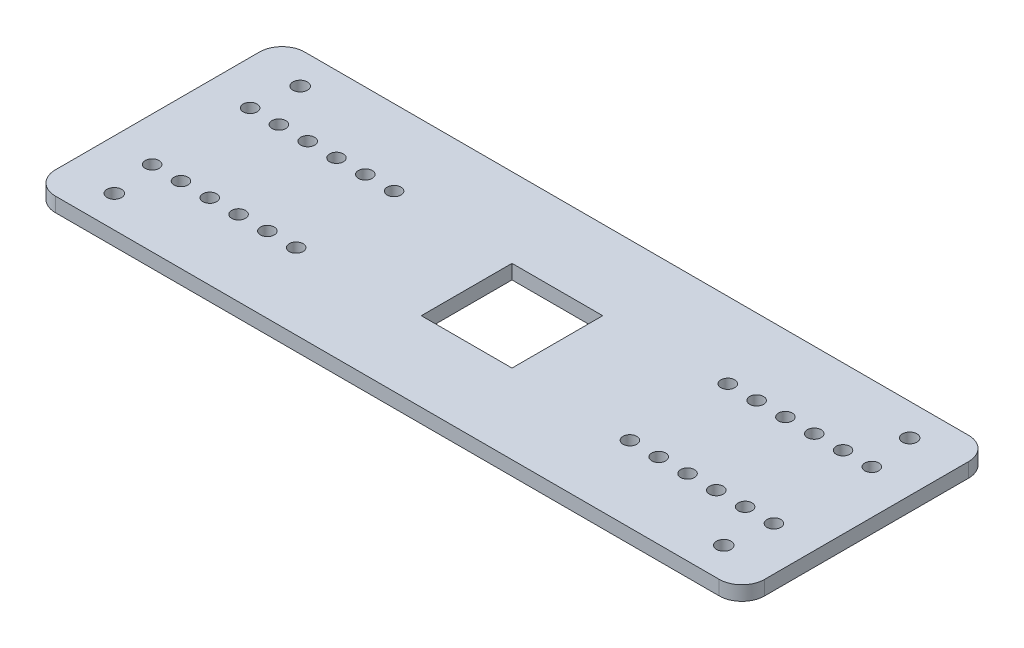
from build123d import *

# Parameters (mm, degrees)
SKETCH1_W           = 156.4
SKETCH1_H           = 55
BOSS_EXTRUDE1_DEPTH = 3.175
SKETCH2_R           = 1.524
CUT_EXTRUDE1_DEPTH  = 83.955232656
SKETCH4_R           = 1.6
CUT_EXTRUDE2_DEPTH  = 83.955232656
SKETCH5_W           = 20
SKETCH5_H           = 20
CUT_EXTRUDE3_DEPTH  = 83.955232656
FILLET1_R           = 5


with BuildPart() as part:
    # Sketch1 → Boss-Extrude1 (new body)
    with BuildSketch(Plane(origin=(0, 0, 0), x_dir=(1, 0, 0), z_dir=(0, 1, 0))):
        Rectangle(SKETCH1_W, SKETCH1_H)
    extrude(amount=BOSS_EXTRUDE1_DEPTH)

    # Sketch2 → Cut-Extrude1 (cut, through all)
    with BuildSketch(Plane(origin=(0, 3.175, 0), x_dir=(1, 0, 0), z_dir=(0, 1, 0))):
        with Locations(Location((-68.547999997, -10.795000003, 0), (0, 0, 270))):
            Circle(SKETCH2_R)
        with Locations(Location((-62.197999997, -10.795000003, 0), (0, 0, 270))):
            Circle(SKETCH2_R)
        with Locations(Location((-55.847999997, -10.795000003, 0), (0, 0, 270))):
            Circle(SKETCH2_R)
        with Locations(Location((-49.497999997, -10.795000003, 0), (0, 0, 270))):
            Circle(SKETCH2_R)
        with Locations(Location((-43.147999997, -10.795000003, 0), (0, 0, 270))):
            Circle(SKETCH2_R)
        with Locations(Location((-36.797999997, -10.795000003, 0), (0, 0, 270))):
            Circle(SKETCH2_R)
        with Locations(Location((-68.547999997, 10.795000003, 0), (0, 0, 90))):
            Circle(SKETCH2_R)
        with Locations(Location((-62.197999997, 10.795000003, 0), (0, 0, 90))):
            Circle(SKETCH2_R)
        with Locations(Location((-55.847999997, 10.795000003, 0), (0, 0, 90))):
            Circle(SKETCH2_R)
        with Locations(Location((-49.497999997, 10.795000003, 0), (0, 0, 90))):
            Circle(SKETCH2_R)
        with Locations(Location((-43.147999997, 10.795000003, 0), (0, 0, 90))):
            Circle(SKETCH2_R)
        with Locations(Location((-36.797999997, 10.795000003, 0), (0, 0, 90))):
            Circle(SKETCH2_R)
        with Locations(Location((36.797999997, 10.795000003, 0), (0, 0, 270))):
            Circle(SKETCH2_R)
        with Locations(Location((43.147999997, 10.795000003, 0), (0, 0, 270))):
            Circle(SKETCH2_R)
        with Locations(Location((49.497999997, 10.795000003, 0), (0, 0, 270))):
            Circle(SKETCH2_R)
        with Locations(Location((55.847999997, 10.795000003, 0), (0, 0, 270))):
            Circle(SKETCH2_R)
        with Locations(Location((62.197999997, 10.795000003, 0), (0, 0, 270))):
            Circle(SKETCH2_R)
        with Locations(Location((68.547999997, 10.795000003, 0), (0, 0, 270))):
            Circle(SKETCH2_R)
        with Locations(Location((68.547999997, -10.795000003, 0), (0, 0, 90))):
            Circle(SKETCH2_R)
        with Locations(Location((62.197999997, -10.795000003, 0), (0, 0, 90))):
            Circle(SKETCH2_R)
        with Locations(Location((55.847999997, -10.795000003, 0), (0, 0, 90))):
            Circle(SKETCH2_R)
        with Locations(Location((49.497999997, -10.795000003, 0), (0, 0, 90))):
            Circle(SKETCH2_R)
        with Locations(Location((43.147999997, -10.795000003, 0), (0, 0, 90))):
            Circle(SKETCH2_R)
        with Locations(Location((36.797999997, -10.795000003, 0), (0, 0, 90))):
            Circle(SKETCH2_R)
    extrude(amount=-CUT_EXTRUDE1_DEPTH, mode=Mode.SUBTRACT)

    # Sketch4 → Cut-Extrude2 (cut, through all)
    with BuildSketch(Plane(origin=(0, 3.175, 0), x_dir=(1, 0, 0), z_dir=(0, 1, 0))):
        with Locations(Location((-67.2, -20.5, 0), (0, 0, 270))):
            Circle(SKETCH4_R)
        with Locations(Location((-67.2, 20.5, 0), (0, 0, 90))):
            Circle(SKETCH4_R)
        with Locations(Location((67.2, 20.5, 0), (0, 0, 270))):
            Circle(SKETCH4_R)
        with Locations(Location((67.2, -20.5, 0), (0, 0, 90))):
            Circle(SKETCH4_R)
    extrude(amount=-CUT_EXTRUDE2_DEPTH, mode=Mode.SUBTRACT)

    # Sketch5 → Cut-Extrude3 (cut, through all)
    with BuildSketch(Plane(origin=(0, 3.175, 0), x_dir=(1, 0, 0), z_dir=(0, 1, 0))):
        Rectangle(SKETCH5_W, SKETCH5_H)
    extrude(amount=-CUT_EXTRUDE3_DEPTH, mode=Mode.SUBTRACT)

    # Fillet1
    fillet1_edges = [part.edges().sort_by_distance(p)[0] for p in [
        (78.2, 1.5875, 27.5),
        (-78.2, 1.5875, 27.5),
        (-78.2, 1.5875, -27.5),
        (78.2, 1.5875, -27.5),
    ]]
    fillet(fillet1_edges, radius=FILLET1_R)


solid = part.part
